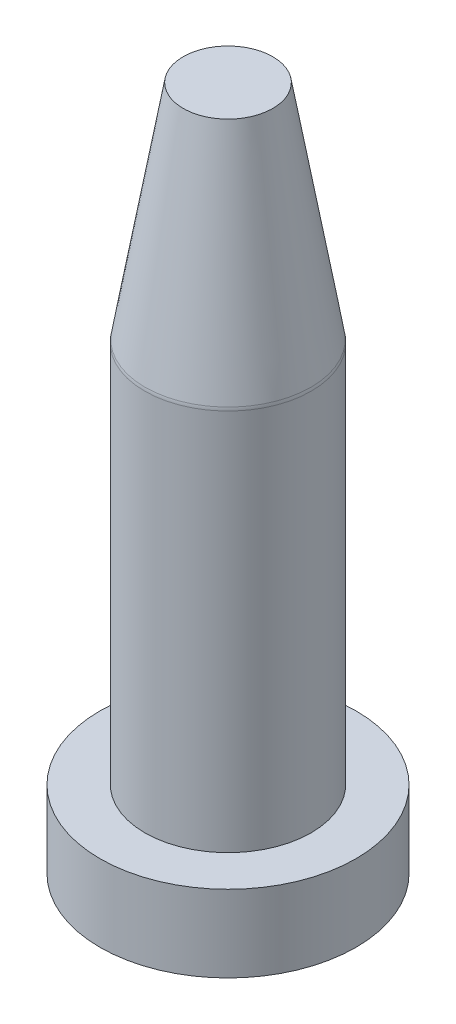
from build123d import *

# Parameters (mm, degrees)
FILLET_1_R = 3


with BuildPart() as part:
    # 草图1 → Revolve 333 (revolve)
    with BuildSketch(Plane.XY, mode=Mode.PRIVATE) as revolve_333_sk:
        Polygon((0, 0), (20, 0), (20, 12), (13, 12), (13, 72), (7, 107), (0, 107), align=None)
    revolve(revolve_333_sk.sketch.rotate(Axis((0, 0, 0), (0, 1, 0)), 90), axis=Axis((0, 0, 0), (0, 1, 0)))

    # 圆角1
    fillet_1_edges = [part.edges().sort_by_distance(p)[0] for p in [
        (0, 72, 13),
    ]]
    fillet(fillet_1_edges, radius=FILLET_1_R)


solid = part.part
